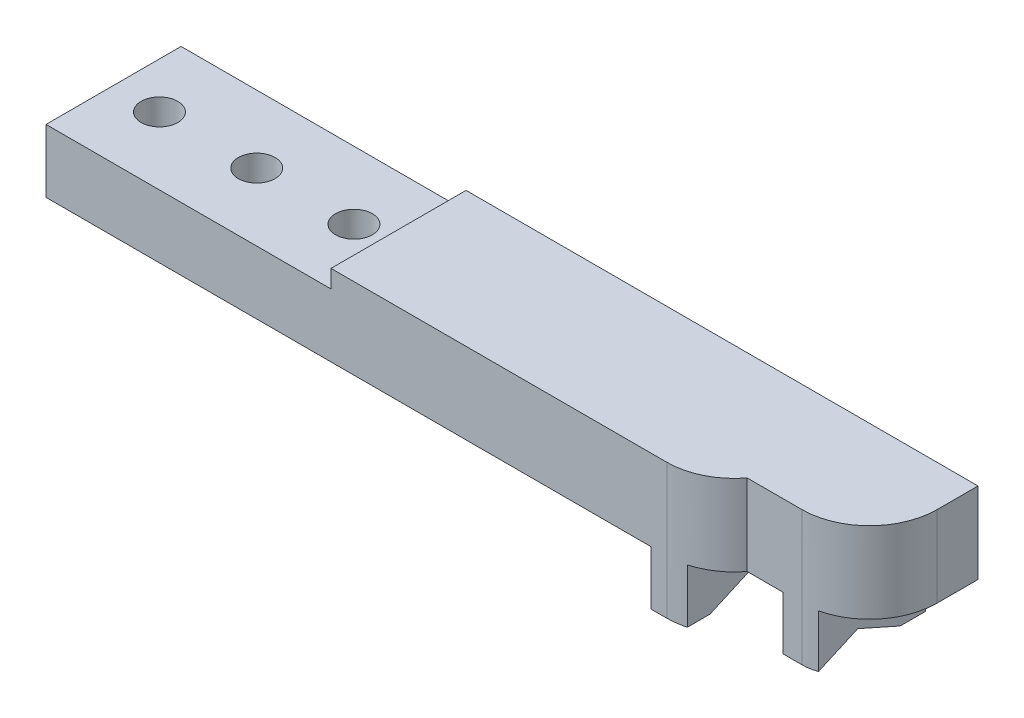
from build123d import *

# Parameters (mm, degrees)
CROQUIS1_W              = 74.93
CROQUIS1_H              = 12.7
SALIENTE_EXTRUIR1_DEPTH = 12.7
CROQUIS2_W              = 26.797
CROQUIS2_H              = 1.6764
CROQUIS2_W_2            = 6.731
CROQUIS2_H_2            = 5.08
CROQUIS2_W_3            = 56.896
CROQUIS2_W_4            = 4.953
CORTAR_EXTRUIR1_DEPTH   = 78.052481466
TALADRO_ROSCADO_8_321_D = 3.4544
CORTAR_EXTRUIR2_DEPTH   = 78.052481466
CORTAR_EXTRUIR3_DEPTH   = 78.052481466


with BuildPart() as part:
    # Croquis1 → Saliente-Extruir1 (new body)
    with BuildSketch(Plane(origin=(0, 0, 0), x_dir=(1, 0, 0), z_dir=(0, 1, 0))):
        with Locations((37.465, -6.35)):
            Rectangle(CROQUIS1_W, CROQUIS1_H)
    extrude(amount=SALIENTE_EXTRUIR1_DEPTH)

    # Croquis2 → Cortar-Extruir1 (cut, through all)
    with BuildSketch(Plane.XY.offset(12.7)):
        with Locations((13.3985, 11.8618)):
            Rectangle(CROQUIS2_W, CROQUIS2_H)
        with Locations((63.4365, 2.54)):
            Rectangle(CROQUIS2_W_2, CROQUIS2_H_2)
        with Locations((28.448, 2.54)):
            Rectangle(CROQUIS2_W_3, CROQUIS2_H_2)
        with Locations((72.4535, 2.54)):
            Rectangle(CROQUIS2_W_4, CROQUIS2_H_2)
    extrude(amount=-CORTAR_EXTRUIR1_DEPTH, mode=Mode.SUBTRACT)

    # Taladro roscado #8-321 (through all)
    with Locations(Plane(origin=(0, 5.08, 0), x_dir=(-1, 0, 0), z_dir=(0, -1, 0))):
        with Locations((-4.318, -6.35), (-13.462, -6.35), (-22.606, -6.35)):
            Hole(TALADRO_ROSCADO_8_321_D / 2)

    # Croquis6 → Cortar-Extruir2 (cut, through all)
    with BuildSketch(Plane.XZ):
        with BuildLine():
            Line((68.58, 10.2), (63.4238, 10.2))
            ThreePointArc((63.4238, 10.2), (61.191404448, 12.04078202), (58.374047531, 12.7))
            Line((58.374047531, 12.7), (74.93, 12.7))
            Line((74.93, 12.7), (74.93, 3.85))
            ThreePointArc((74.93, 3.85), (73.070128061, 8.340128061), (68.58, 10.2))
        make_face()
    extrude(amount=-CORTAR_EXTRUIR2_DEPTH, mode=Mode.SUBTRACT)

    # Croquis7 → Cortar-Extruir3 (cut, through all)
    with BuildSketch(Plane(origin=(74.93, 0, 0), x_dir=(0, 0, -1), z_dir=(1, 0, 0))):
        Polygon((-2.3622, 0), (-6.35, 1.778), (-10.3378, 0), align=None)
    extrude(amount=-CORTAR_EXTRUIR3_DEPTH, mode=Mode.SUBTRACT)


solid = part.part
